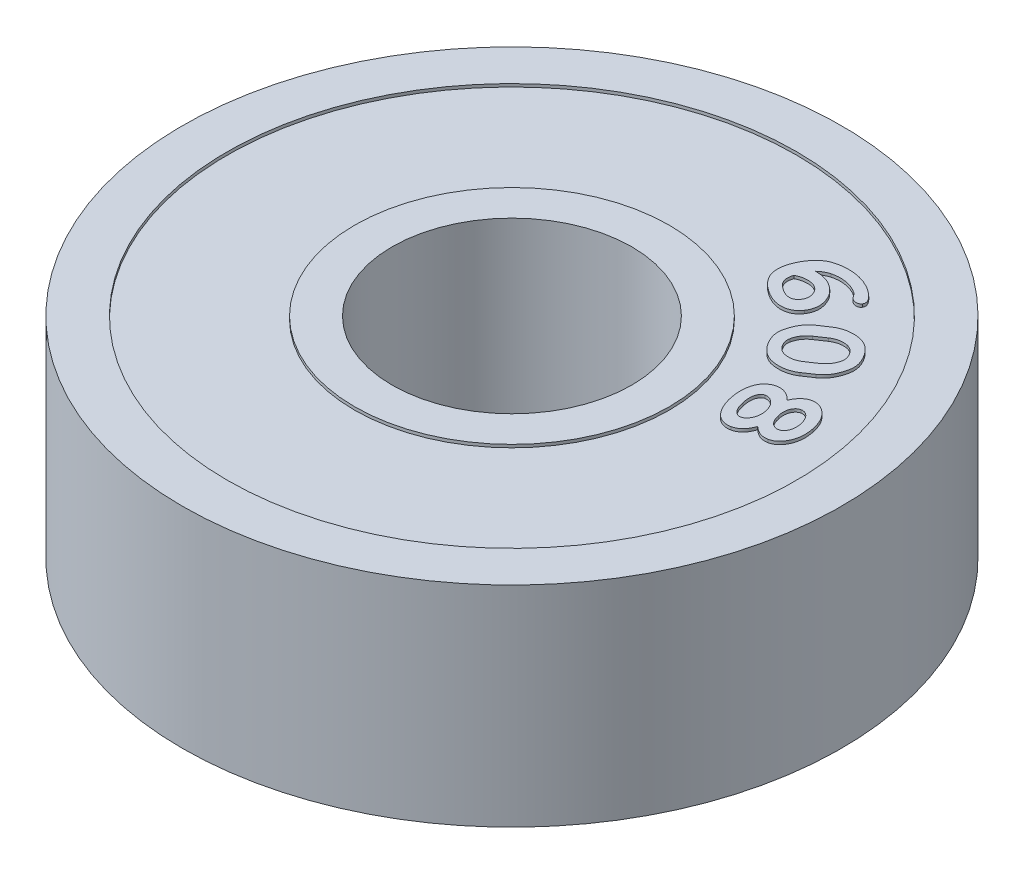
from build123d import *

# Parameters (mm, degrees)
SKETCH1_R           = 11
SKETCH1_R_2         = 9.5
SKETCH1_R_3         = 5.25
SKETCH1_R_4         = 4
BOSS_EXTRUDE1_DEPTH = 7
CUT_EXTRUDE1_START  = 7
SKETCH1_3_R         = 9.5
SKETCH1_3_R_2       = 5.25
CUT_EXTRUDE1_DEPTH  = 0.1
CUT_EXTRUDE2_START  = 0.1
SKETCH1_4_R         = 9.5
SKETCH1_4_R_2       = 5.25
CUT_EXTRUDE2_DEPTH  = 0.1
BOSS_EXTRUDE2_START = 6.9
BOSS_EXTRUDE2_DEPTH = 0.1


with BuildPart() as part:
    # Sketch1 → Boss-Extrude1 (new body)
    # profile 1 of 3: a face of its own
    with BuildSketch(Plane(origin=(0, 0, 0), x_dir=(1, 0, 0), z_dir=(0, 1, 0))):
        with Locations(Location((0, 0, 0), (0, 0, 270))):
            Circle(SKETCH1_R)
        Circle(SKETCH1_R_2, mode=Mode.SUBTRACT)
    # profile 2 of 3: a face of its own
    with BuildSketch(Plane(origin=(0, 0, 0), x_dir=(1, 0, 0), z_dir=(0, 1, 0))):
        Circle(SKETCH1_R_2)
        Circle(SKETCH1_R_3, mode=Mode.SUBTRACT)
    # profile 3 of 3: a face of its own
    with BuildSketch(Plane(origin=(0, 0, 0), x_dir=(1, 0, 0), z_dir=(0, 1, 0))):
        Circle(SKETCH1_R_3)
        with Locations(Location((0, 0, 0), (0, 0, 270))):
            Circle(SKETCH1_R_4, mode=Mode.SUBTRACT)
    extrude(amount=BOSS_EXTRUDE1_DEPTH)

    # Sketch1<3> → Cut-Extrude1 (cut)
    with BuildSketch(Plane(origin=(0, 0, 0), x_dir=(1, 0, 0), z_dir=(0, 1, 0)).offset(CUT_EXTRUDE1_START)):
        with Locations(Location((0, 0, 0), (0, 0, 270))):
            Circle(SKETCH1_3_R)
        with Locations(Location((0, 0, 0), (0, 0, 270))):
            Circle(SKETCH1_3_R_2, mode=Mode.SUBTRACT)
    extrude(amount=-CUT_EXTRUDE1_DEPTH, mode=Mode.SUBTRACT)

    # Sketch1<4> → Cut-Extrude2 (cut)
    with BuildSketch(Plane(origin=(0, 0, 0), x_dir=(1, 0, 0), z_dir=(0, 1, 0)).offset(CUT_EXTRUDE2_START)):
        with Locations(Location((0, 0, 0), (0, 0, 270))):
            Circle(SKETCH1_4_R)
        with Locations(Location((0, 0, 0), (0, 0, 270))):
            Circle(SKETCH1_4_R_2, mode=Mode.SUBTRACT)
    extrude(amount=-CUT_EXTRUDE2_DEPTH, mode=Mode.SUBTRACT)

    # Sketch3 → Boss-Extrude2 (add)
    # profile 1 of 3: a face of its own
    with BuildSketch(Plane(origin=(0, 0, 0), x_dir=(1, 0, 0), z_dir=(0, 1, 0)).offset(BOSS_EXTRUDE2_START)):
        with BuildLine():
            add(Edge.make_bspline(
                [(7.29467665, 0.907824994), (7.283365182, 0.877154822), (7.261542088, 0.817983185), (7.219895288, 0.736381196), (7.172967705, 0.664339054), (7.119836792, 0.602584783), (7.061415496, 0.550031849), (6.996633812, 0.508795133), (6.926862396, 0.475786291), (6.876942346, 0.463131998), (6.851632295, 0.456716123)],
                knots=[0, 0, 0, 0, 1.182163852, 2.280736097, 3.30773782, 4.286428859, 5.221065833, 6.140227483, 7.057073532, 8, 8, 8, 8], degree=3))
            add(Edge.make_bspline(
                [(6.851632295, 0.456716123), (6.823152517, 0.452017104), (6.766576941, 0.442682419), (6.680063204, 0.446496468), (6.594292323, 0.463787576), (6.524461246, 0.49031811), (6.469770278, 0.518761242), (6.429492695, 0.545223296), (6.390085007, 0.575569303), (6.351613564, 0.610038367), (6.314225404, 0.648831994), (6.278687823, 0.692635083), (6.243253572, 0.739754241), (6.198008627, 0.809194572), (6.145968977, 0.903086297), (6.093587701, 1.02453479), (6.048239489, 1.154012781), (6.02719731, 1.244616973), (6.016450843, 1.29088951)],
                knots=[0, 0, 0, 0, 1.052698409, 2.09120378, 3.143830535, 4.23994968, 4.808560239, 5.394515737, 5.998848166, 6.625123315, 7.280960676, 7.965827812, 8.685572801, 9.43501752, 10.993619675, 12.602373853, 14.264795706, 16, 16, 16, 16], degree=3))
            add(Edge.make_bspline(
                [(6.016450843, 1.29088951), (6.007417715, 1.337471652), (5.989771356, 1.428470603), (5.977307722, 1.564310186), (5.976692237, 1.69517448), (5.985573591, 1.800788535), (5.999184054, 1.881397067), (6.011670647, 1.938295421), (6.026662463, 1.99192484), (6.04469826, 2.042049143), (6.066238245, 2.088398576), (6.089068628, 2.132107309), (6.115555259, 2.172173037), (6.153979358, 2.220402965), (6.207160815, 2.27317191), (6.277828404, 2.324808267), (6.354903678, 2.363917064), (6.410095247, 2.378381222), (6.437821811, 2.385647575)],
                knots=[0, 0, 0, 0, 1.74497246, 3.408831329, 5.009875412, 6.555087779, 7.301014027, 8.016424735, 8.69741056, 9.348593601, 9.97376003, 10.576647432, 11.161290038, 11.737638486, 12.843521543, 13.905640539, 14.947857567, 16, 16, 16, 16], degree=3))
            add(Edge.make_bspline(
                [(6.437821811, 2.385647575), (6.46344681, 2.39017951), (6.514104928, 2.399138702), (6.591335564, 2.397883204), (6.667495801, 2.386603646), (6.742457363, 2.362552122), (6.816513979, 2.328188424), (6.888934597, 2.281406261), (6.960317422, 2.223831288), (7.00431009, 2.178646223), (7.027035521, 2.155304833)],
                knots=[0, 0, 0, 0, 0.938950788, 1.856213967, 2.778031638, 3.713675559, 4.692021562, 5.721637609, 6.823059186, 8, 8, 8, 8], degree=3))
            add(Edge.make_bspline(
                [(7.027035521, 2.155304833), (7.039665994, 2.182762411), (7.064042915, 2.235755771), (7.107183008, 2.308891696), (7.153955527, 2.373064256), (7.204197107, 2.428779025), (7.258139236, 2.475884698), (7.316813534, 2.512483716), (7.378234913, 2.542102814), (7.421944339, 2.553042826), (7.443870198, 2.558530639)],
                knots=[0, 0, 0, 0, 1.202140154, 2.320140749, 3.372584295, 4.357083467, 5.300566363, 6.211285497, 7.102731252, 8, 8, 8, 8], degree=3))
            add(Edge.make_bspline(
                [(7.443870198, 2.558530639), (7.4654782, 2.562264699), (7.508469354, 2.569693962), (7.573811975, 2.571178674), (7.638678511, 2.563306159), (7.702927521, 2.547176832), (7.766307375, 2.521890306), (7.829385665, 2.488981077), (7.891399999, 2.446605952), (7.952326434, 2.396401012), (8.01115289, 2.339638562), (8.064519011, 2.275488314), (8.113668957, 2.206125093), (8.158203917, 2.130945561), (8.196826517, 2.049451204), (8.23052408, 1.962273917), (8.260025104, 1.869589116), (8.274961775, 1.805120854), (8.282579876, 1.772240317)],
                knots=[0, 0, 0, 0, 0.826442035, 1.644284227, 2.45482411, 3.284927977, 4.135893718, 5.023257108, 5.963740923, 6.963562464, 7.998933463, 9.042555331, 10.10649616, 11.203288861, 12.334430816, 13.504381564, 14.7271679, 16, 16, 16, 16], degree=3))
            add(Edge.make_bspline(
                [(8.282579876, 1.772240317), (8.289040439, 1.739043033), (8.301676934, 1.674111037), (8.313302896, 1.577463649), (8.318063077, 1.484140295), (8.315443653, 1.394002967), (8.306675281, 1.307135809), (8.290427167, 1.223482518), (8.267365563, 1.143095405), (8.237084706, 1.067079178), (8.202210387, 0.996323305), (8.162933515, 0.932225843), (8.119086344, 0.876106139), (8.071154486, 0.827652465), (8.019733041, 0.786235315), (7.963451618, 0.753519013), (7.903801463, 0.726922239), (7.861414544, 0.71650543), (7.840039553, 0.711252413)],
                knots=[0, 0, 0, 0, 1.275481588, 2.494769377, 3.668671056, 4.797265622, 5.893340864, 6.958582717, 8.007637545, 9.043339609, 10.041053677, 10.980263984, 11.874112809, 12.72114432, 13.546656745, 14.356448362, 15.171185318, 16, 16, 16, 16], degree=3))
            add(Edge.make_bspline(
                [(7.840039553, 0.711252413), (7.817424823, 0.707375557), (7.772581948, 0.699688116), (7.703773241, 0.700274029), (7.635010954, 0.709618963), (7.566350809, 0.729934932), (7.497750978, 0.759410601), (7.429425475, 0.799466519), (7.360710954, 0.848908114), (7.317180267, 0.8877469), (7.29467665, 0.907824994)],
                knots=[0, 0, 0, 0, 0.910349601, 1.805137368, 2.722099794, 3.660428075, 4.641569253, 5.682684451, 6.802040885, 8, 8, 8, 8], degree=3))
        make_face()
        with BuildLine():
            add(Edge.make_bspline(
                [(7.735704876, 1.162865317), (7.74605647, 1.16540851), (7.766582606, 1.170451399), (7.795416396, 1.183492946), (7.822518525, 1.199645143), (7.847268514, 1.219907488), (7.86948809, 1.244154361), (7.890522223, 1.271297378), (7.908384161, 1.303154151), (7.925002145, 1.337852609), (7.938517262, 1.375884142), (7.94913839, 1.416149734), (7.956214241, 1.458841143), (7.959469056, 1.503694946), (7.960105946, 1.550679676), (7.956911106, 1.599680558), (7.950378885, 1.650868913), (7.943418383, 1.685416707), (7.93983794, 1.703187897)],
                knots=[0, 0, 0, 0, 0.7985782, 1.583497616, 2.364252435, 3.161933971, 3.9738433, 4.82887559, 5.732997145, 6.708935577, 7.714173511, 8.757223347, 9.831148865, 10.956983032, 12.129862321, 13.355455246, 14.639661091, 16, 16, 16, 16], degree=3))
            add(Edge.make_bspline(
                [(7.93983794, 1.703187897), (7.93566987, 1.72104903), (7.927551275, 1.755839066), (7.912356897, 1.80581538), (7.895269954, 1.852303571), (7.876196011, 1.89539287), (7.854591244, 1.934970047), (7.830024736, 1.970591258), (7.804765021, 2.003869757), (7.776223034, 2.032267558), (7.747203129, 2.05753548), (7.717494341, 2.078936306), (7.687190261, 2.095667612), (7.656527632, 2.107982156), (7.625701016, 2.116052158), (7.594551361, 2.120318725), (7.562959767, 2.119778283), (7.542124645, 2.116260135), (7.531571811, 2.11447822)],
                knots=[0, 0, 0, 0, 1.371343227, 2.671111721, 3.903482407, 5.073354349, 6.192463768, 7.269300158, 8.307394838, 9.311396136, 10.273563905, 11.183532847, 12.043920045, 12.855878986, 13.648255545, 14.421268487, 15.200384259, 16, 16, 16, 16], degree=3))
            add(Edge.make_bspline(
                [(7.531571811, 2.11447822), (7.52105088, 2.111947579), (7.500344006, 2.106966873), (7.471098066, 2.093819756), (7.444139126, 2.077232431), (7.41865722, 2.05732729), (7.396418271, 2.032855225), (7.375314258, 2.005408026), (7.356758175, 1.973848481), (7.340341869, 1.938952167), (7.326580681, 1.901044211), (7.316792627, 1.860601196), (7.309531227, 1.818011049), (7.306166849, 1.77297747), (7.306181863, 1.725632663), (7.309996938, 1.676176229), (7.316353143, 1.624457062), (7.32334119, 1.589573799), (7.326934714, 1.571635478)],
                knots=[0, 0, 0, 0, 0.806021719, 1.586379652, 2.379821865, 3.164999347, 3.989911753, 4.839975105, 5.74520295, 6.71546981, 7.714865903, 8.748742008, 9.816426512, 10.935718003, 12.114251404, 13.346065572, 14.63524438, 16, 16, 16, 16], degree=3))
            add(Edge.make_bspline(
                [(7.326934714, 1.571635478), (7.330891294, 1.553931326), (7.338604816, 1.51941633), (7.35394068, 1.470017516), (7.370983747, 1.424022141), (7.390152217, 1.38130309), (7.411785363, 1.342062045), (7.435481434, 1.306102478), (7.461371699, 1.273456623), (7.48936292, 1.244582956), (7.518425062, 1.219266102), (7.548415733, 1.198440889), (7.578789999, 1.181634394), (7.609506575, 1.168894924), (7.640692864, 1.160565837), (7.672265061, 1.157218118), (7.704144551, 1.157489278), (7.725149845, 1.161067355), (7.735704876, 1.162865317)],
                knots=[0, 0, 0, 0, 1.358352974, 2.648166812, 3.870716876, 5.030987077, 6.151891034, 7.223456425, 8.253344015, 9.267970872, 10.231681517, 11.135869384, 11.99763625, 12.827285522, 13.62093269, 14.406153638, 15.199102041, 16, 16, 16, 16], degree=3))
        make_face(mode=Mode.SUBTRACT)
        with BuildLine():
            add(Edge.make_bspline(
                [(6.740241166, 0.89572822), (6.751247709, 0.898650462), (6.773245183, 0.904490803), (6.804872665, 0.918179158), (6.834290984, 0.937113452), (6.861492261, 0.960729437), (6.887689616, 0.988027723), (6.910938496, 1.020683747), (6.933508451, 1.057143696), (6.953243805, 1.098076066), (6.970076656, 1.141955334), (6.984042474, 1.187682142), (6.993422979, 1.234963757), (6.999096026, 1.283850492), (7.000336388, 1.334248671), (6.998442787, 1.386128445), (6.992356979, 1.439547841), (6.985289956, 1.475240681), (6.981672618, 1.493510478)],
                knots=[0, 0, 0, 0, 0.771281265, 1.541468574, 2.325013692, 3.13292944, 3.978884416, 4.88323808, 5.844265444, 6.883376087, 7.957837344, 9.028004247, 10.120246192, 11.220769986, 12.360209042, 13.534187767, 14.737845201, 16, 16, 16, 16], degree=3))
            add(Edge.make_bspline(
                [(6.981672618, 1.493510478), (6.977595841, 1.511565598), (6.96954996, 1.547198993), (6.95270591, 1.59826925), (6.933485252, 1.646640634), (6.911597315, 1.692021824), (6.885885431, 1.733946575), (6.858609545, 1.773723307), (6.826779968, 1.809329734), (6.793533102, 1.842463327), (6.758590697, 1.871463039), (6.723101353, 1.895829139), (6.687931181, 1.915629552), (6.652690016, 1.930675139), (6.617392417, 1.940309988), (6.582136334, 1.944769879), (6.546970109, 1.945194271), (6.523975591, 1.941121807), (6.512418585, 1.939074994)],
                knots=[0, 0, 0, 0, 1.247691392, 2.462430487, 3.621792069, 4.756924762, 5.854858106, 6.936296182, 8.004354635, 9.070006192, 10.100063671, 11.061793657, 11.969755589, 12.817837612, 13.639702556, 14.428160799, 15.209996317, 16, 16, 16, 16], degree=3))
            add(Edge.make_bspline(
                [(6.512418585, 1.939074994), (6.503741612, 1.936855136), (6.486376927, 1.932412672), (6.46214955, 1.92026946), (6.439097922, 1.905434801), (6.418826901, 1.885384433), (6.399481376, 1.862358222), (6.382648086, 1.834757938), (6.366784499, 1.80389619), (6.353393564, 1.769086455), (6.342012114, 1.730586034), (6.334880911, 1.688113172), (6.330238121, 1.642148519), (6.329384125, 1.592603231), (6.332167899, 1.539615319), (6.337672085, 1.482904542), (6.346882584, 1.422563765), (6.355003979, 1.381250311), (6.359192779, 1.35994193)],
                knots=[0, 0, 0, 0, 0.652371195, 1.305549853, 1.969249571, 2.646315598, 3.378522296, 4.161613928, 5.001314411, 5.910588615, 6.881536377, 7.928675085, 9.05085833, 10.253746339, 11.543746716, 12.924802737, 14.413894985, 16, 16, 16, 16], degree=3))
            add(Edge.make_bspline(
                [(6.359192779, 1.35994193), (6.364036188, 1.338555426), (6.373391549, 1.297245999), (6.39017168, 1.238077718), (6.408090283, 1.183656658), (6.427812997, 1.134016176), (6.448802377, 1.089117196), (6.471495145, 1.048841554), (6.496118105, 1.0136826), (6.52191419, 0.983100681), (6.548615177, 0.957475257), (6.575546332, 0.93592073), (6.602797936, 0.918718245), (6.630162168, 0.905465389), (6.657536066, 0.896028646), (6.685110933, 0.891641589), (6.712869593, 0.890736144), (6.731030608, 0.894048382), (6.740241166, 0.89572822)],
                knots=[0, 0, 0, 0, 1.592527235, 3.076070195, 4.46536623, 5.752555188, 6.953552701, 8.06308512, 9.105842975, 10.066842474, 10.964459183, 11.789723175, 12.568469805, 13.299879074, 13.994527091, 14.662618162, 15.321732122, 16, 16, 16, 16], degree=3))
        make_face(mode=Mode.SUBTRACT)
    # profile 2 of 3: a face of its own
    with BuildSketch(Plane(origin=(0, 0, 0), x_dir=(1, 0, 0), z_dir=(0, 1, 0)).offset(BOSS_EXTRUDE2_START)):
        with BuildLine():
            Line((6.759493602, 3.385768923), (6.440945214, 3.171555213))
            add(Edge.make_bspline(
                [(6.440945214, 3.171555213), (6.417012867, 3.156483379), (6.369032196, 3.126266671), (6.292193489, 3.089100219), (6.211620001, 3.059321332), (6.127446992, 3.036524117), (6.039560057, 3.021031274), (5.948024884, 3.012489912), (5.853012423, 3.011283958), (5.75548429, 3.016224319), (5.658033577, 3.03095514), (5.563241863, 3.056605332), (5.473229319, 3.094375718), (5.387115056, 3.142628985), (5.305694121, 3.202560731), (5.229085996, 3.27391051), (5.155594083, 3.355211171), (5.112686365, 3.416353437), (5.090642795, 3.44776489)],
                knots=[0, 0, 0, 0, 0.883145977, 1.77057173, 2.660818602, 3.563651427, 4.491411278, 5.445715065, 6.432708018, 7.457947724, 8.49360301, 9.506009388, 10.517912119, 11.535598517, 12.583421285, 13.66818511, 14.802044812, 16, 16, 16, 16], degree=3))
            add(Edge.make_bspline(
                [(5.090642795, 3.44776489), (5.078584471, 3.46649967), (5.054953849, 3.503214101), (5.022300822, 3.558767873), (4.99440748, 3.614218211), (4.969344489, 3.668665277), (4.948648564, 3.72270956), (4.931941914, 3.776074205), (4.919342707, 3.828978196), (4.909846188, 3.8815958), (4.905496413, 3.935410777), (4.904913596, 3.991010761), (4.909052821, 4.048805451), (4.917765022, 4.108746256), (4.93115813, 4.170752), (4.948158547, 4.235275157), (4.970012426, 4.301859455), (4.995996223, 4.369675783), (5.025445547, 4.437068963), (5.060052041, 4.501196812), (5.097737164, 4.561774456), (5.139114982, 4.618591255), (5.184789836, 4.671043245), (5.233668854, 4.720015002), (5.286160074, 4.765394272), (5.324100501, 4.791837738), (5.343162956, 4.805123761)],
                knots=[0, 0, 0, 0, 1.041967693, 2.041937647, 3.011818865, 3.943683725, 4.844042145, 5.716363553, 6.556819704, 7.386146433, 8.214206615, 9.078564698, 9.984358235, 10.921113074, 11.908938765, 12.949572407, 14.040404051, 15.184469836, 16.345277303, 17.477217572, 18.589126787, 19.679816924, 20.760498431, 21.838376906, 22.913933075, 24, 24, 24, 24], degree=3))
            Line((5.343162956, 4.805123761), (5.661711343, 5.019337471))
            add(Edge.make_bspline(
                [(5.661711343, 5.019337471), (5.685630304, 5.034436293), (5.73339417, 5.064587191), (5.810069971, 5.101215473), (5.890233777, 5.131050231), (5.973964031, 5.154429815), (6.061752958, 5.169919388), (6.153123617, 5.178217985), (6.248130324, 5.180341743), (6.34561772, 5.174979036), (6.443085307, 5.160998978), (6.537868141, 5.135786747), (6.628121382, 5.098497171), (6.714218624, 5.050498345), (6.795644982, 4.990721027), (6.872052039, 4.919494036), (6.945552122, 4.838203926), (6.988458688, 4.777060172), (7.010501666, 4.745647955)],
                knots=[0, 0, 0, 0, 0.884391702, 1.766045221, 2.652621379, 3.558117282, 4.482011041, 5.437660924, 6.42614393, 7.452829792, 8.48915963, 9.501616707, 10.512940496, 11.53664797, 12.578602019, 13.664895961, 14.800355033, 16, 16, 16, 16], degree=3))
            add(Edge.make_bspline(
                [(7.010501666, 4.745647955), (7.022590091, 4.727098791), (7.046353968, 4.690634152), (7.078633557, 4.635210095), (7.107001396, 4.580238718), (7.131171024, 4.525620531), (7.151917682, 4.47186204), (7.168853564, 4.418558672), (7.181263999, 4.365594643), (7.190628281, 4.312797441), (7.195837799, 4.259040893), (7.196164507, 4.203408106), (7.192157749, 4.145606326), (7.183154099, 4.085586433), (7.170748582, 4.023246092), (7.153386488, 3.958496168), (7.131509171, 3.891675565), (7.106453418, 3.823216512), (7.076428779, 3.755897827), (7.042794402, 3.691298118), (7.005304879, 3.630438555), (6.964036326, 3.573334978), (6.918507367, 3.520410051), (6.869473415, 3.471197509), (6.816390709, 3.426184953), (6.7785125, 3.39927872), (6.759493602, 3.385768923)],
                knots=[0, 0, 0, 0, 1.034297039, 2.033259778, 2.99517544, 3.92288604, 4.822337577, 5.686288733, 6.533532472, 7.362023865, 8.189957289, 9.053444751, 9.958325932, 10.894137228, 11.887067996, 12.926653464, 14.023852603, 15.171339319, 16.330977568, 17.465042293, 18.571691303, 19.667626177, 20.753166917, 21.829959704, 22.910408456, 24, 24, 24, 24], degree=3))
        make_face()
        with BuildLine():
            add(Edge.make_bspline(
                [(6.506469408, 3.762281019), (6.525585476, 3.775846391), (6.563343999, 3.802641043), (6.614335783, 3.849132489), (6.660517624, 3.898999265), (6.700993591, 3.953261906), (6.736104452, 4.011616745), (6.765104658, 4.074246197), (6.789142255, 4.140706905), (6.800563745, 4.186892391), (6.806368602, 4.210365697)],
                knots=[0, 0, 0, 0, 1.016197404, 2.007217906, 2.987455576, 3.961357224, 4.938989319, 5.936902937, 6.951451795, 8, 8, 8, 8], degree=3))
            add(Edge.make_bspline(
                [(6.806368602, 4.210365697), (6.808749978, 4.22393522), (6.813516812, 4.25109752), (6.814084414, 4.292776443), (6.810628048, 4.334659776), (6.802430231, 4.377101394), (6.78920967, 4.419756765), (6.771423039, 4.462731937), (6.749029345, 4.506098207), (6.731006568, 4.534098766), (6.721691182, 4.548571342)],
                knots=[0, 0, 0, 0, 0.921790773, 1.845161191, 2.78283139, 3.734386798, 4.735017898, 5.769829573, 6.847297638, 8, 8, 8, 8], degree=3))
            add(Edge.make_bspline(
                [(6.721691182, 4.548571342), (6.712004477, 4.562185262), (6.692994736, 4.588901993), (6.661181952, 4.625272123), (6.627177733, 4.657257667), (6.591237629, 4.685118118), (6.553389191, 4.709052843), (6.513071201, 4.728281121), (6.470835282, 4.743504237), (6.441529563, 4.750302861), (6.426832311, 4.753712471)],
                knots=[0, 0, 0, 0, 1.086430723, 2.132073447, 3.137233983, 4.118825276, 5.086196963, 6.044324947, 7.019200043, 8, 8, 8, 8], degree=3))
            add(Edge.make_bspline(
                [(6.426832311, 4.753712471), (6.404377881, 4.757574162), (6.359858339, 4.765230589), (6.292728915, 4.767817753), (6.226731107, 4.764415672), (6.161654793, 4.75430673), (6.097653152, 4.737108101), (6.034702832, 4.71293578), (5.972359213, 4.68309622), (5.933129667, 4.657718769), (5.91322344, 4.644841503)],
                knots=[0, 0, 0, 0, 1.012703671, 2.007848938, 2.9809667, 3.949336184, 4.93205224, 5.923259664, 6.946200826, 8, 8, 8, 8], degree=3))
            Line((5.91322344, 4.644841503), (5.594675053, 4.430627794))
            add(Edge.make_bspline(
                [(5.594675053, 4.430627794), (5.575401589, 4.416884281), (5.537518927, 4.389870931), (5.486101495, 4.343287249), (5.440352359, 4.292878389), (5.399363873, 4.238745097), (5.365326731, 4.179682322), (5.335880605, 4.117285763), (5.312476325, 4.050495241), (5.301422335, 4.004161081), (5.295783924, 3.980526987)],
                knots=[0, 0, 0, 0, 1.023721417, 2.012159965, 2.995208965, 3.96657326, 4.944202999, 5.939516705, 6.948990187, 8, 8, 8, 8], degree=3))
            add(Edge.make_bspline(
                [(5.295783924, 3.980526987), (5.29345632, 3.967123573), (5.288796494, 3.940290144), (5.287416958, 3.899141755), (5.290946955, 3.857513024), (5.299884415, 3.81537289), (5.312890983, 3.772635603), (5.330901173, 3.729335358), (5.35342427, 3.685616342), (5.371650146, 3.657298565), (5.380965376, 3.642825374)],
                knots=[0, 0, 0, 0, 0.911327881, 1.824464368, 2.751600592, 3.706054013, 4.707422783, 5.742997327, 6.84644786, 8, 8, 8, 8], degree=3))
            add(Edge.make_bspline(
                [(5.380965376, 3.642825374), (5.39044299, 3.629342983), (5.409099971, 3.602802472), (5.441152588, 3.567298099), (5.474479974, 3.534996689), (5.510285131, 3.507235894), (5.548406969, 3.48392527), (5.588433353, 3.464715183), (5.630446863, 3.449316754), (5.659609385, 3.442588501), (5.67431215, 3.439196342)],
                knots=[0, 0, 0, 0, 1.077542517, 2.121176293, 3.124353952, 4.111803328, 5.079154728, 6.043000766, 7.013346683, 8, 8, 8, 8], degree=3))
            add(Edge.make_bspline(
                [(5.67431215, 3.439196342), (5.69676624, 3.435336519), (5.741119547, 3.427712255), (5.808081897, 3.425071986), (5.874064241, 3.428558581), (5.939194795, 3.438436035), (6.003243157, 3.456035472), (6.066229331, 3.479690012), (6.12846082, 3.510103541), (6.167823294, 3.535235442), (6.187921021, 3.54806731)],
                knots=[0, 0, 0, 0, 1.012785964, 2.000544449, 2.973741286, 3.94957583, 4.925152651, 5.923434169, 6.939745176, 8, 8, 8, 8], degree=3))
            Line((6.187921021, 3.54806731), (6.506469408, 3.762281019))
        make_face(mode=Mode.SUBTRACT)
    # profile 3 of 3: a face of its own
    with BuildSketch(Plane(origin=(0, 0, 0), x_dir=(1, 0, 0), z_dir=(0, 1, 0)).offset(BOSS_EXTRUDE2_START)):
        with BuildLine():
            add(Edge.make_bspline(
                [(3.774966472, 6.361212286), (3.80641217, 6.359928867), (3.867768649, 6.357424674), (3.956795209, 6.347164298), (4.040314675, 6.332681849), (4.118928877, 6.313544953), (4.194129828, 6.288467974), (4.267178178, 6.257240124), (4.338815171, 6.219234052), (4.384397686, 6.189369866), (4.407526956, 6.174216318)],
                knots=[0, 0, 0, 0, 1.127765042, 2.20048196, 3.209379813, 4.164619276, 5.097772622, 6.047471879, 7.009257135, 8, 8, 8, 8], degree=3))
            add(Edge.make_bspline(
                [(4.407526956, 6.174216318), (4.431312003, 6.157090322), (4.47820342, 6.123326998), (4.543204003, 6.067238313), (4.601016342, 6.006228462), (4.654123464, 5.942311772), (4.69990951, 5.873309409), (4.739784573, 5.800598328), (4.773826979, 5.723938265), (4.801242341, 5.644194435), (4.821363573, 5.563268375), (4.833420493, 5.483087489), (4.83580152, 5.404806431), (4.83011443, 5.328080401), (4.814062882, 5.253606081), (4.790232114, 5.180662373), (4.757527844, 5.109557976), (4.728981875, 5.065196367), (4.714482601, 5.042663898)],
                knots=[0, 0, 0, 0, 1.079903371, 2.12899307, 3.158158028, 4.174577417, 5.187823204, 6.204845966, 7.227751704, 8.275378492, 9.308614802, 10.297268785, 11.25753442, 12.189308061, 13.125617604, 14.057679242, 15.013442435, 16, 16, 16, 16], degree=3))
            add(Edge.make_bspline(
                [(4.714482601, 5.042663898), (4.699970881, 5.022651993), (4.67142434, 4.983285834), (4.621625421, 4.931149536), (4.567444492, 4.886525017), (4.508969282, 4.849217864), (4.445817979, 4.819968966), (4.378541787, 4.797629436), (4.306773748, 4.78325087), (4.231307957, 4.77554888), (4.152951498, 4.776392394), (4.072944359, 4.784403498), (3.99155387, 4.800708626), (3.909248917, 4.825939823), (3.825010957, 4.857450846), (3.740256057, 4.8984334), (3.653926014, 4.946800057), (3.597332918, 4.983847996), (3.568313246, 5.00284535)],
                knots=[0, 0, 0, 0, 0.922057101, 1.813812653, 2.682776814, 3.537153147, 4.395801274, 5.274490429, 6.177404182, 7.122949567, 8.101456607, 9.097556687, 10.12100776, 11.194606539, 12.308280284, 13.475409802, 14.705446687, 16, 16, 16, 16], degree=3))
            add(Edge.make_bspline(
                [(3.568313246, 5.00284535), (3.544423033, 5.019544126), (3.497794941, 5.052136219), (3.432675916, 5.10454525), (3.372529243, 5.157245637), (3.317953258, 5.21124167), (3.26888076, 5.266226501), (3.225346572, 5.322255944), (3.187392672, 5.379339861), (3.154790239, 5.437544852), (3.128094605, 5.49735308), (3.106201799, 5.558442122), (3.089946047, 5.62136081), (3.07957963, 5.685838633), (3.073993566, 5.751885521), (3.073432318, 5.819301382), (3.07859895, 5.888396446), (3.089370043, 5.958548221), (3.104555926, 6.029339307), (3.123424536, 6.100007102), (3.147731791, 6.169686711), (3.174519735, 6.239481303), (3.2066934, 6.308306416), (3.241806718, 6.3772063), (3.281708926, 6.445246397), (3.31104853, 6.489537692), (3.32587373, 6.511917931)],
                knots=[0, 0, 0, 0, 1.2017158, 2.345467285, 3.445050285, 4.49840969, 5.509374988, 6.482276405, 7.421970524, 8.333844661, 9.230107362, 10.119838409, 11.007138123, 11.905861326, 12.809804133, 13.738268646, 14.683108462, 15.663970918, 16.662778059, 17.667885676, 18.677972111, 19.704721813, 20.749501088, 21.80928964, 22.893041618, 24, 24, 24, 24], degree=3))
            add(Edge.make_bspline(
                [(3.32587373, 6.511917931), (3.344465034, 6.537759108), (3.381007191, 6.588551262), (3.441560679, 6.658188116), (3.506026656, 6.720242519), (3.574093076, 6.774611546), (3.64563971, 6.822316664), (3.721515358, 6.861149316), (3.800451921, 6.894247587), (3.883337199, 6.917533078), (3.967432324, 6.935887901), (4.05203142, 6.950177436), (4.136668481, 6.959777111), (4.221466502, 6.964596637), (4.306264448, 6.96602631), (4.391199174, 6.961537241), (4.476184561, 6.953753211), (4.560982411, 6.941075289), (4.644898589, 6.9239356), (4.727660788, 6.902740804), (4.809009108, 6.877604403), (4.888639138, 6.847891712), (4.966526, 6.813480611), (5.042578141, 6.774483909), (5.117400974, 6.731794275), (5.165582577, 6.700178239), (5.18978502, 6.684296963)],
                knots=[0, 0, 0, 0, 1.105722475, 2.173354017, 3.201451221, 4.210745894, 5.196828219, 6.183843304, 7.168230585, 8.165824323, 9.170108882, 10.158659372, 11.145691722, 12.128207609, 13.109057036, 14.090948332, 15.081978036, 16.073557835, 17.068500327, 18.056826693, 19.041023532, 20.025635834, 21.008429189, 21.997961778, 22.994341949, 24, 24, 24, 24], degree=3))
            add(Edge.make_bspline(
                [(5.18978502, 6.684296963), (5.20823025, 6.671541667), (5.244010184, 6.646799027), (5.293987982, 6.607748936), (5.339503415, 6.569008785), (5.380407857, 6.530162037), (5.416906504, 6.491531813), (5.448226024, 6.452479216), (5.475360363, 6.413744407), (5.490078995, 6.386888012), (5.497244698, 6.373813092)],
                knots=[0, 0, 0, 0, 1.21943421, 2.365450461, 3.447730809, 4.46892335, 5.432180125, 6.335497501, 7.189644137, 8, 8, 8, 8], degree=3))
            add(Edge.make_bspline(
                [(5.497244698, 6.373813092), (5.504451852, 6.357604933), (5.517894178, 6.327374503), (5.524799496, 6.280573743), (5.520090654, 6.236685265), (5.506216868, 6.212198928), (5.499260827, 6.199921963)],
                knots=[0, 0, 0, 0, 1.161524996, 2.166402731, 3.080670593, 4, 4, 4, 4], degree=3))
            add(Edge.make_bspline(
                [(5.499260827, 6.199921963), (5.491636376, 6.190244767), (5.476593423, 6.17115177), (5.446028804, 6.149958167), (5.410581555, 6.136421203), (5.371168729, 6.130094187), (5.329923115, 6.130981275), (5.288905186, 6.140208949), (5.248340919, 6.155011387), (5.223638459, 6.170697955), (5.210954375, 6.178752608)],
                knots=[0, 0, 0, 0, 0.918674283, 1.812533832, 2.744982367, 3.740119456, 4.78494273, 5.814188988, 6.877641779, 8, 8, 8, 8], degree=3))
            add(Edge.make_bspline(
                [(5.210954375, 6.178752608), (5.203216769, 6.184774996), (5.185989548, 6.198183407), (5.16187283, 6.225109996), (5.134779008, 6.258509615), (5.117489547, 6.284267207), (5.108131795, 6.298208253)],
                knots=[0, 0, 0, 0, 0.741624511, 1.65117336, 2.728720437, 4, 4, 4, 4], degree=3))
            add(Edge.make_bspline(
                [(5.108131795, 6.298208253), (5.096075525, 6.31485741), (5.072915791, 6.346839944), (5.041867888, 6.371204555), (5.026982601, 6.382885673)],
                knots=[0, 0, 0, 0, 1.041140617, 2, 2, 2, 2], degree=3))
            add(Edge.make_bspline(
                [(5.026982601, 6.382885673), (4.996117192, 6.402545717), (4.933533104, 6.442409304), (4.830736323, 6.490565357), (4.719866386, 6.529644726), (4.602334792, 6.56033985), (4.480159624, 6.580128905), (4.35578104, 6.583716477), (4.230614316, 6.573708006), (4.148620526, 6.555103681), (4.10712373, 6.545688092)],
                knots=[0, 0, 0, 0, 0.912273373, 1.849766455, 2.82424883, 3.841957321, 4.877075505, 5.904603627, 6.939526583, 8, 8, 8, 8], degree=3))
            add(Edge.make_bspline(
                [(4.10712373, 6.545688092), (4.078280713, 6.536849372), (4.019650175, 6.518882495), (3.9353323, 6.477424637), (3.852418139, 6.425520699), (3.801217428, 6.383008554), (3.774966472, 6.361212286)],
                knots=[0, 0, 0, 0, 0.943490373, 1.917876627, 2.932481047, 4, 4, 4, 4], degree=3))
        make_face()
        with BuildLine():
            add(Edge.make_bspline(
                [(3.526982601, 5.879357447), (3.522802115, 5.862423334), (3.514688375, 5.829556582), (3.505324239, 5.781181539), (3.500266252, 5.73515261), (3.498844192, 5.691696535), (3.499952125, 5.650510942), (3.505524421, 5.611829291), (3.514667201, 5.575510127), (3.531802592, 5.52940397), (3.564711164, 5.473561029), (3.618218686, 5.409168229), (3.687543667, 5.34557014), (3.741407933, 5.307023744), (3.769926149, 5.286615511)],
                knots=[0, 0, 0, 0, 0.897396147, 1.741720754, 2.533097308, 3.276968586, 3.977645718, 4.650022869, 5.283192567, 5.901373522, 7.17515572, 8.594129443, 10.196775652, 12, 12, 12, 12], degree=3))
            add(Edge.make_bspline(
                [(3.769926149, 5.286615511), (3.784945546, 5.276708088), (3.81435404, 5.257309014), (3.85888965, 5.23178117), (3.902366443, 5.210210028), (3.945037392, 5.193767309), (3.98626663, 5.180186699), (4.026689503, 5.171754401), (4.065993685, 5.166985814), (4.104175741, 5.166496552), (4.140906406, 5.169811786), (4.175672075, 5.177629333), (4.208510016, 5.188646973), (4.239615928, 5.203308049), (4.268589744, 5.222149794), (4.295268706, 5.245070234), (4.320238221, 5.2713462), (4.334657066, 5.291145614), (4.342002762, 5.301232447)],
                knots=[0, 0, 0, 0, 1.339198616, 2.622196829, 3.819280867, 4.948095024, 6.024046691, 7.047003979, 8.016652053, 8.967318326, 9.884567443, 10.755537039, 11.61384126, 12.458642502, 13.30861303, 14.178234445, 15.0718995, 16, 16, 16, 16], degree=3))
            add(Edge.make_bspline(
                [(4.342002762, 5.301232447), (4.349892465, 5.313312984), (4.365396715, 5.337052747), (4.382747254, 5.375455245), (4.396739942, 5.414088441), (4.405314863, 5.454105855), (4.409246785, 5.494842741), (4.408963649, 5.536479322), (4.402826909, 5.57875275), (4.393701117, 5.621538247), (4.379737201, 5.663417143), (4.364071131, 5.704059618), (4.344077609, 5.741727259), (4.321983408, 5.777341069), (4.29662251, 5.810234337), (4.268267153, 5.840596967), (4.23681542, 5.868543257), (4.213958597, 5.885091642), (4.202385827, 5.89347035)],
                knots=[0, 0, 0, 0, 1.024928205, 2.014111828, 2.989333911, 3.943455211, 4.916257476, 5.896374146, 6.897043595, 7.949680344, 9.004215202, 10.03400981, 11.044339551, 12.032511813, 13.012628483, 13.993546409, 14.984100942, 16, 16, 16, 16], degree=3))
            add(Edge.make_bspline(
                [(4.202385827, 5.89347035), (4.182242511, 5.905458887), (4.140633065, 5.930223248), (4.068682913, 5.954231715), (3.988156527, 5.969178358), (3.899988956, 5.974238932), (3.807164287, 5.969679876), (3.71297151, 5.951882922), (3.618415561, 5.922954745), (3.557907932, 5.894103342), (3.526982601, 5.879357447)],
                knots=[0, 0, 0, 0, 0.796174165, 1.644633148, 2.564568879, 3.578993933, 4.644483855, 5.720440306, 6.834921497, 8, 8, 8, 8], degree=3))
        make_face(mode=Mode.SUBTRACT)
    extrude(amount=BOSS_EXTRUDE2_DEPTH)


solid = part.part
